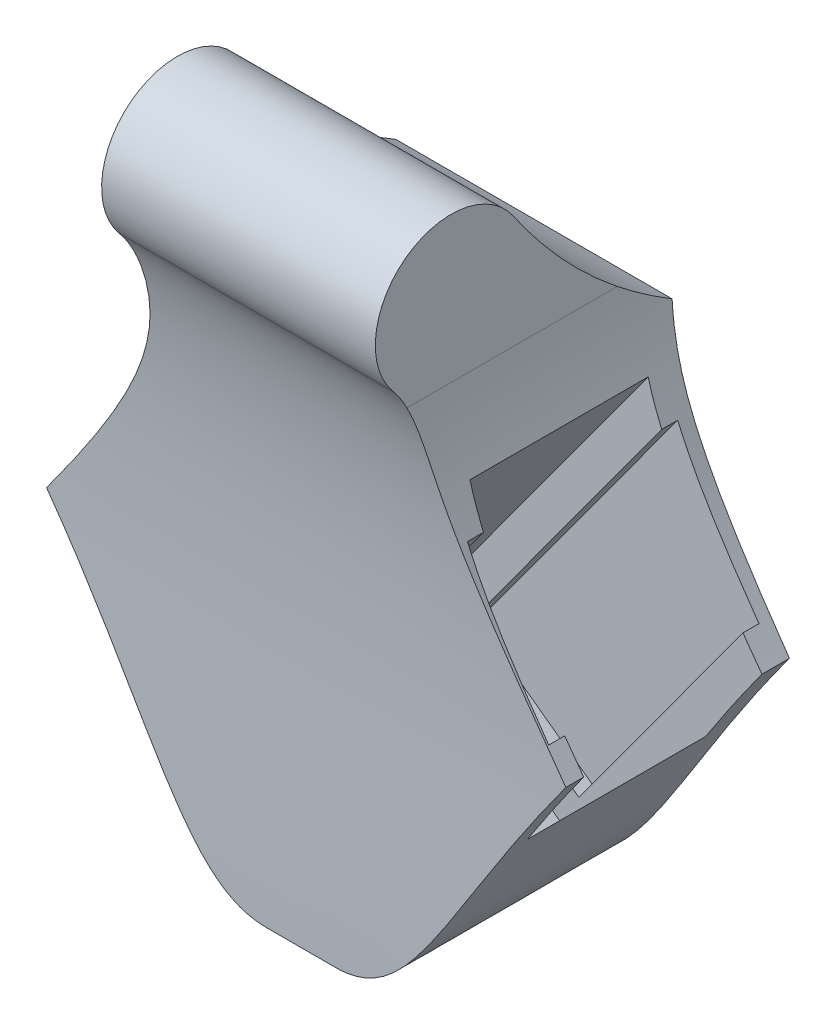
from build123d import *

# Parameters (mm, degrees)
BOSS_EXTRUDE1_DEPTH      = 70
BOSS_EXTRUDE1_DEPTH_BACK = 90
CUT_EXTRUDE1_DEPTH       = 125.755860093
CUT_EXTRUDE1_DEPTH_BACK  = 125.755860093
SKETCH10_OUTSIDE_W       = 205.76
SKETCH10_OUTSIDE_H       = 165.428
CUT_EXTRUDE4_DEPTH       = 6.4
CUT_EXTRUDE4_DEPTH_BACK  = 105.067072527
SKETCH15_W               = 36.6
SKETCH15_H               = 30.6
CUT_EXTRUDE5_DEPTH       = 12.5


with BuildPart() as part:
    # Sketch8 → Boss-Extrude1 (new, two sides: drawn at the far end of the back side and taken through both)
    with BuildSketch(Plane.XY.offset(-BOSS_EXTRUDE1_DEPTH_BACK)):
        with BuildLine():
            Line((-6, -45.667592609), (6, -45.667592609))
            add(Edge.make_bspline(
                [(44.587269323, 0), (24.684424598, -27.160649005), (19.273508518, -45.667592609), (6, -45.667592609)],
                knots=[0, 0, 0, 0, 1, 1, 1, 1], degree=3))
            add(Edge.make_bspline(
                [(23.5, 49), (23.5, 34.38564976), (25.853420885, 25.6357926), (44.587269323, 0)],
                knots=[0, 0, 0, 0, 1, 1, 1, 1], degree=3))
            Line((23.5, 49), (23.5, 74))
            Line((23.5, 74), (-23.5, 74))
            Line((-23.5, 74), (-23.5, 49))
            add(Edge.make_bspline(
                [(-23.5, 49), (-23.5, 34.38564976), (-25.853420885, 25.6357926), (-44.587269323, 0)],
                knots=[0, 0, 0, 0, 1, 1, 1, 1], degree=3))
            add(Edge.make_bspline(
                [(-44.587269323, 0), (-24.684424598, -27.160649005), (-19.273508518, -45.667592609), (-6, -45.667592609)],
                knots=[0, 0, 0, 0, 1, 1, 1, 1], degree=3))
        make_face()
    extrude(amount=BOSS_EXTRUDE1_DEPTH + BOSS_EXTRUDE1_DEPTH_BACK)

    # Sketch10 outside → Cut-Extrude1 (cut, two sides: drawn at the far end of the back side and taken through both)
    with BuildSketch(Plane(origin=(0, 0, 0), x_dir=(0, 0, -1), z_dir=(1, 0, 0)).offset(-CUT_EXTRUDE1_DEPTH_BACK)):
        with Locations((10, 14.166)):
            Rectangle(SKETCH10_OUTSIDE_W, SKETCH10_OUTSIDE_H)
        with BuildLine():
            Line((19.25, -45.667592609), (20.75, 42.667592609))
            add(Edge.make_bspline(
                [(-6.284762028, 68.360956134), (4.979548326, 51.963661564), (20.75, 42.667592609)],
                knots=[0, 0, 0, 1, 1, 1], degree=2))
            ThreePointArc((-6.284762028, 68.360956134), (-24.867699079, 71.348879707), (-26.958577761, 52.643761074))
            add(Edge.make_bspline(
                [(-26.958577761, 52.643761074), (-14.483902489, 37.777022003), (-19.25, -11.054872301), (-19.25, -45.667592609)],
                knots=[0, 0, 0, 0, 1, 1, 1, 1], degree=3))
            Line((-19.25, -45.667592609), (19.25, -45.667592609))
        make_face(mode=Mode.SUBTRACT)
    extrude(amount=CUT_EXTRUDE1_DEPTH + CUT_EXTRUDE1_DEPTH_BACK, mode=Mode.SUBTRACT)

    # l_hip_x_top_room → Cut-Extrude4 (cut, two sides: drawn at the far end of the back side and taken through both)
    with BuildSketch(Plane(origin=(-7.847220638, -10.738301926, 0), x_dir=(-0.807391122257892, 0.5900165893423182, 0), z_dir=(-0.5900165893423182, -0.807391122257892, 0)).offset(-CUT_EXTRUDE4_DEPTH_BACK)):
        Polygon((-5.7, 15.3), (0.1, 15.3), (0.1, -15.3), (-5.7, -15.3), (-5.7, -18.05), (-30.7, -18.05), (-30.7, -15.3), (-36.5, -15.3), (-36.5, 15.3), (-30.7, 15.3), (-30.7, 18.05), (-5.7, 18.05), align=None)
    extrude(amount=CUT_EXTRUDE4_DEPTH + CUT_EXTRUDE4_DEPTH_BACK, mode=Mode.SUBTRACT)

    # Sketch15 → Cut-Extrude5 (cut)
    with BuildSketch(Plane(origin=(-7.847220638, -10.738301926, 0), x_dir=(0.807391122257892, -0.5900165893423182, 0), z_dir=(0.5900165893423182, 0.807391122257892, 0))):
        with Locations((18.2, 0)):
            Rectangle(SKETCH15_W, SKETCH15_H)
    extrude(amount=-CUT_EXTRUDE5_DEPTH, mode=Mode.SUBTRACT)


solid = part.part
